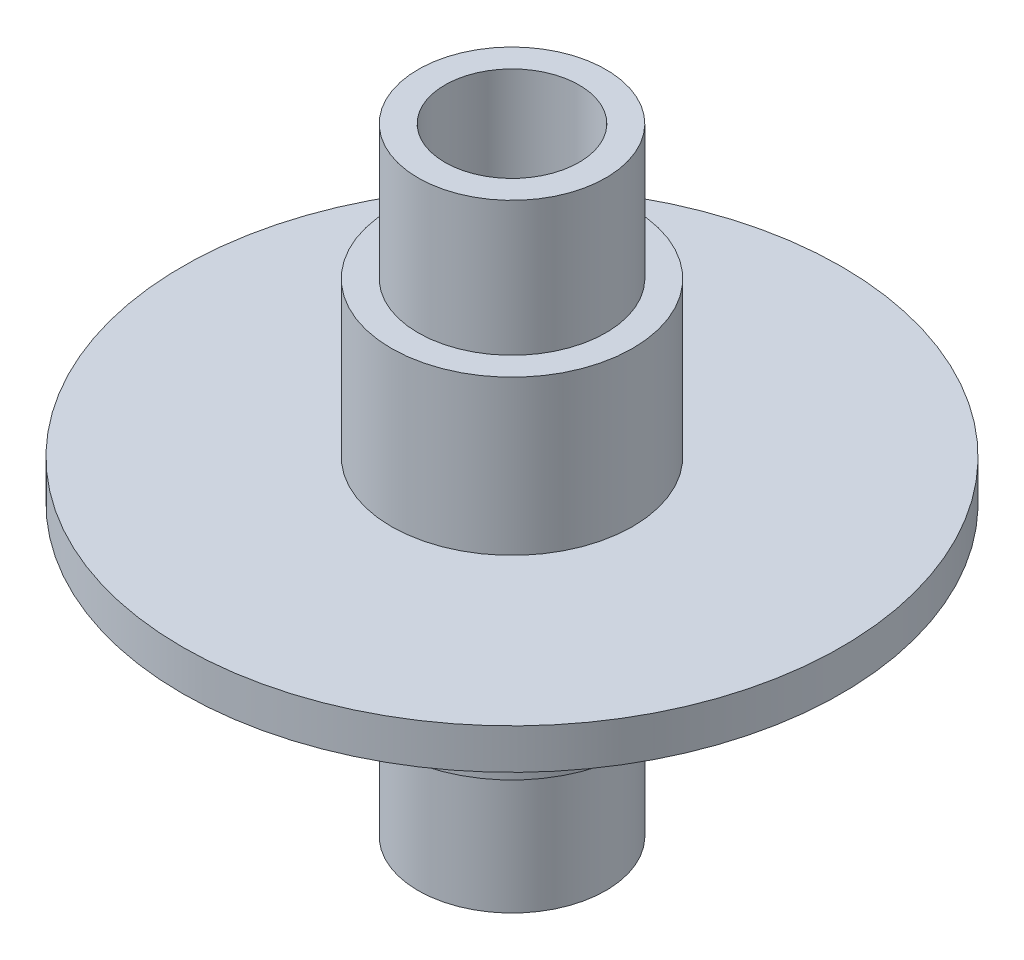
from build123d import *


with BuildPart() as part:
    # Sketch1 → Revolve1 (revolve)
    with BuildSketch(Plane.XY, mode=Mode.PRIVATE) as revolve1_sk:
        Polygon((-9, -6.793729373), (-24.561056106, -6.793729373), (-24.561056106, -9.793729373), (-9, -9.793729373), (-9, -21.293729373), (-7, -21.293729373), (-7, -31.293729373), (-5, -31.293729373), (-5, 14.706270627), (-7, 14.706270627), (-7, 4.706270627), (-9, 4.706270627), align=None)
    revolve(revolve1_sk.sketch.rotate(Axis((0, 17.724422442, 0), (0, -1, 0)), 270), axis=Axis((0, 17.724422442, 0), (0, -1, 0)))


solid = part.part
